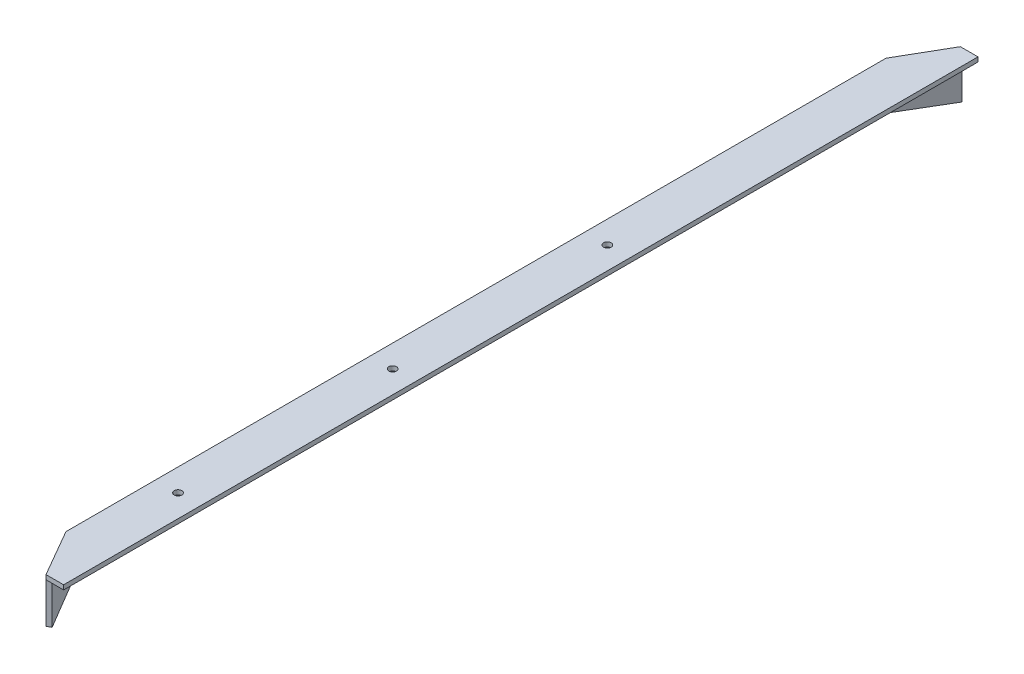
from build123d import *

# Parameters (mm, degrees)
BOSS_EXTRUDE1_DEPTH     = 640
BOSS_EXTRUDE2_DEPTH     = 63
BOSS_EXTRUDE3_DEPTH     = 7
CUT_EXTRUDE1_DEPTH      = 10
CUT_EXTRUDE1_DEPTH_BACK = 10
SKETCH28_R              = 6


with BuildPart() as part:
    # Sketch1 → Boss-Extrude1 (new body)
    with BuildSketch(Plane.XY):
        Polygon((0, 0), (0, 70), (70, 70), (70, 63), (7, 63), (7, 0), align=None)
    extrude(amount=BOSS_EXTRUDE1_DEPTH)

    # Sketch23 → Boss-Extrude2 (add)
    with BuildSketch(Plane(origin=(0, 0, 0), x_dir=(1, 0, 0), z_dir=(0, 1, 0))):
        Polygon((0, -640), (42.5, -713.612159322), (48.562177826, -710.112159322), (7, -640), align=None)
    extrude(amount=BOSS_EXTRUDE2_DEPTH)

    # Sketch25 → Boss-Extrude3 (add)
    with BuildSketch(Plane(origin=(0, 63, 0), x_dir=(1, 0, 0), z_dir=(0, 1, 0))):
        Polygon((70, -640), (0, -640), (42.5, -713.612159322), (70, -713.612159322), align=None)
    extrude(amount=BOSS_EXTRUDE3_DEPTH)

    # Mirror1: part across plane


with BuildPart() as part_1:
    add(part.part)
    add(part.part.mirror(Plane.XY))

    # Sketch28 → Cut-Extrude1 (cut, two sides: drawn at the far end of the back side and taken through both)
    with BuildSketch(Plane(origin=(0, 70, 0), x_dir=(1, 0, 0), z_dir=(0, 1, 0)).offset(-CUT_EXTRUDE1_DEPTH_BACK)):
        with Locations((35, -500)):
            Circle(SKETCH28_R)
        with Locations((35, -165)):
            Circle(SKETCH28_R)
        with Locations((35, 170)):
            Circle(SKETCH28_R)
    extrude(amount=CUT_EXTRUDE1_DEPTH + CUT_EXTRUDE1_DEPTH_BACK, mode=Mode.SUBTRACT)


solid = part_1.part
